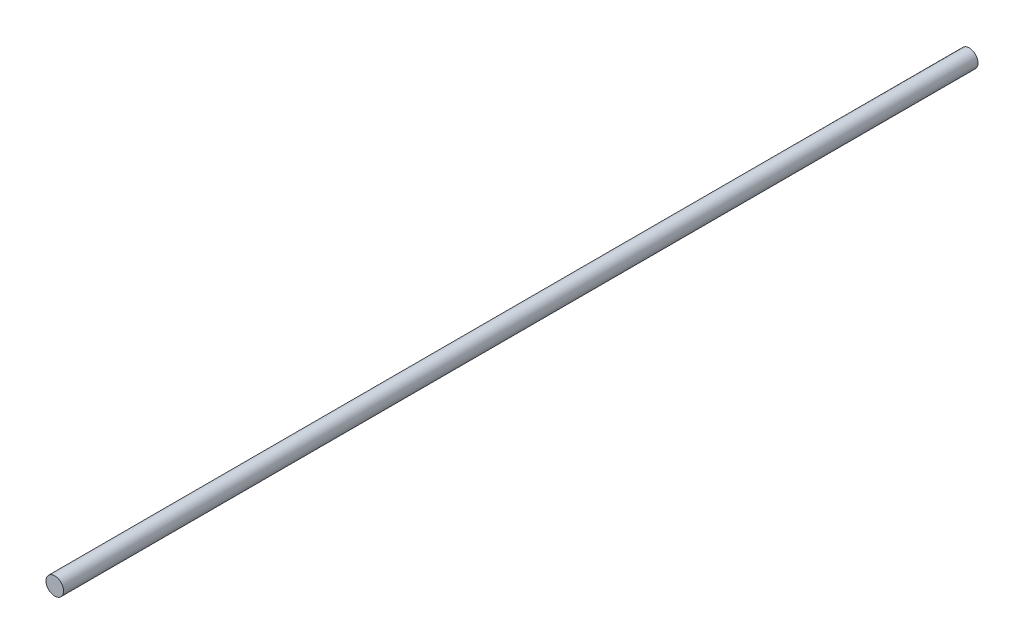
from build123d import *

# Parameters (mm, degrees)
SKETCH1_R           = 6.35
BOSS_EXTRUDE1_DEPTH = 330.2


with BuildPart() as part:
    # Sketch1 → Boss-Extrude1 (new, symmetric)
    with BuildSketch(Plane.XY):
        Circle(SKETCH1_R)
    extrude(amount=BOSS_EXTRUDE1_DEPTH, both=True)


solid = part.part
